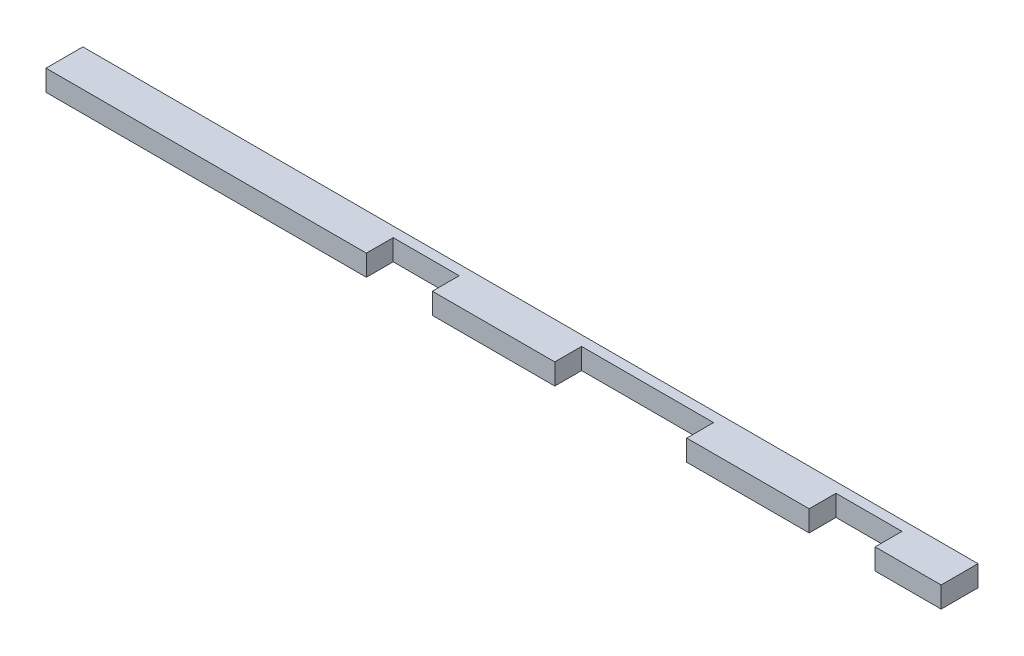
from build123d import *

# Parameters (mm, degrees)
BOSS_EXTRUDE1_DEPTH = 1.5875


with BuildPart() as part:
    # Sketch1 → Boss-Extrude1 (new body)
    with BuildSketch(Plane(origin=(0, 0, 0), x_dir=(1, 0, 0), z_dir=(0, 1, 0))):
        Polygon((0, 0), (24.27563042, 0), (24.27563042, 2.032), (29.27563042, 2.032), (29.27563042, 0), (38.55125958, 0), (38.55125958, 2.032), (48.55125958, 2.032), (48.55125958, 0), (57.82689, 0), (57.82689, 2.032), (62.82689, 2.032), (62.82689, 0), (67.82689, 0), (67.82689, 2.794), (0, 2.794), align=None)
    extrude(amount=BOSS_EXTRUDE1_DEPTH)


solid = part.part
